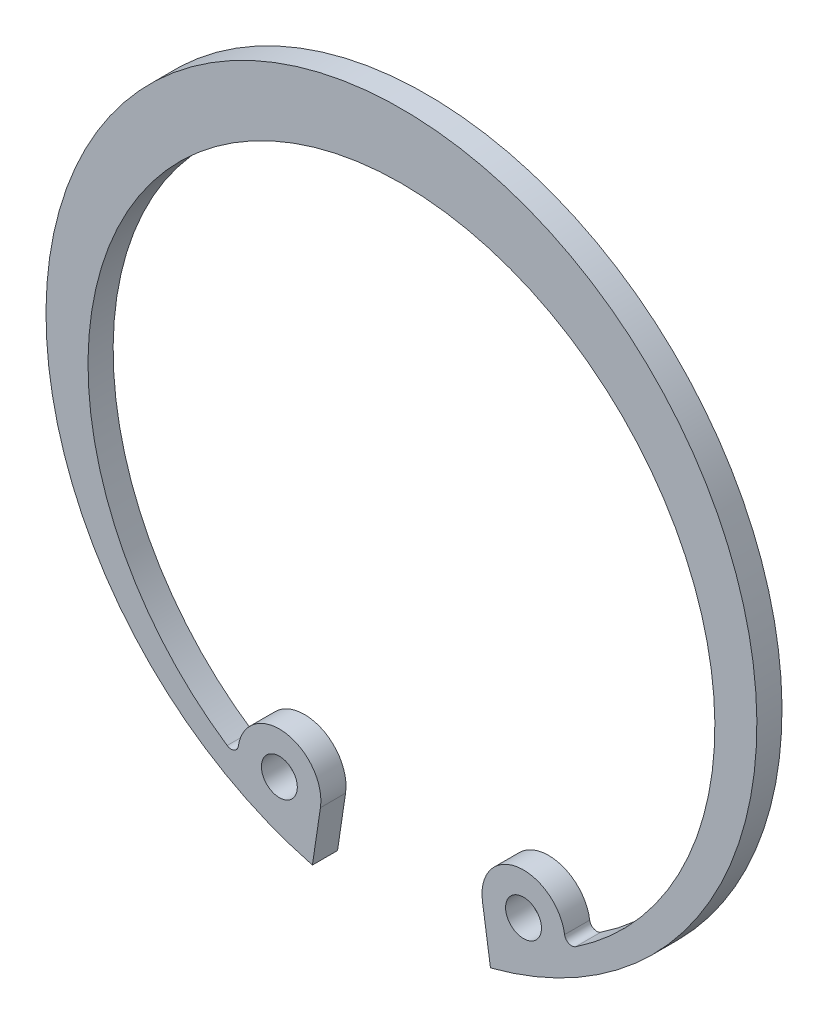
from build123d import *

# Parameters (mm, degrees)
SKETCH1_R           = 1.25
BOSS_EXTRUDE1_DEPTH = 1.75


with BuildPart() as part:
    # Sketch1 → Boss-Extrude1 (new body)
    with BuildSketch(Plane.XY):
        with BuildLine():
            Line((-5.640944603, -20.220126485), (-6.2, -23.960853491))
            ThreePointArc((-6.2, -23.960853491), (0, 24.75), (6.2, -23.960853491))
            Line((6.2, -23.960853491), (5.640944603, -20.220126485))
            ThreePointArc((5.640944603, -20.220126485), (8.07675095, -16.933181584), (11.360251312, -19.373629229))
            ThreePointArc((11.360251312, -19.373629229), (11.652044799, -19.758093576), (12.132925437, -19.716740416))
            ThreePointArc((12.132925437, -19.716740416), (0, 20.25), (-12.132925437, -19.716740416))
            ThreePointArc((-12.132925437, -19.716740416), (-11.652044799, -19.758093576), (-11.360251312, -19.373629229))
            ThreePointArc((-11.360251312, -19.373629229), (-8.07675095, -16.933181584), (-5.640944603, -20.220126485))
        make_face()
        with Locations((-8.5, -19.792837793)):
            Circle(SKETCH1_R, mode=Mode.SUBTRACT)
        with Locations((8.5, -19.792837793)):
            Circle(SKETCH1_R, mode=Mode.SUBTRACT)
    extrude(amount=BOSS_EXTRUDE1_DEPTH)


solid = part.part
